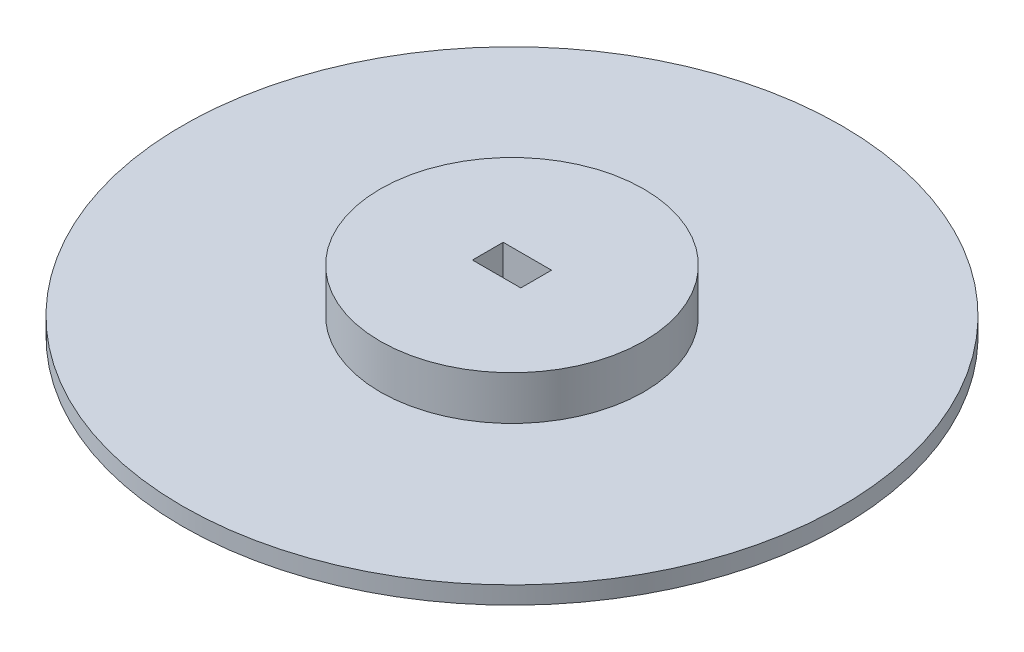
from build123d import *

# Parameters (mm, degrees)
SKETCH_1_R          = 15
EXTRUDE_1_DEPTH     = 7
SKETCH_2_W          = 5.5
SKETCH_2_H          = 3.5
CUT_EXTRUDE_1_DEPTH = 23.338307904
SKETCH_3_R          = 37.5
SKETCH_3_R_2        = 10.340446081
EXTRUDE_2_DEPTH     = 2


with BuildPart() as part:
    # 草图1 → 凸台-拉伸1 (new body)
    with BuildSketch(Plane(origin=(0, 0, 0), x_dir=(1, 0, 0), z_dir=(0, 1, 0))):
        with Locations(Location((0, 0, 0), (0, 0, 270))):
            Circle(SKETCH_1_R)
    extrude(amount=EXTRUDE_1_DEPTH)

    # 草图2 → 切除-拉伸1 (cut, through all)
    with BuildSketch(Plane(origin=(0, 7, 0), x_dir=(1, 0, 0), z_dir=(0, 1, 0))):
        Rectangle(SKETCH_2_W, SKETCH_2_H)
    extrude(amount=-CUT_EXTRUDE_1_DEPTH, mode=Mode.SUBTRACT)

    # 草图3 → 凸台-拉伸2 (add)
    with BuildSketch(Plane.XZ):
        with Locations(Location((0, 0, 0), (0, 0, 270))):
            Circle(SKETCH_3_R)
        Circle(SKETCH_3_R_2, mode=Mode.SUBTRACT)
    extrude(amount=-EXTRUDE_2_DEPTH)


solid = part.part
